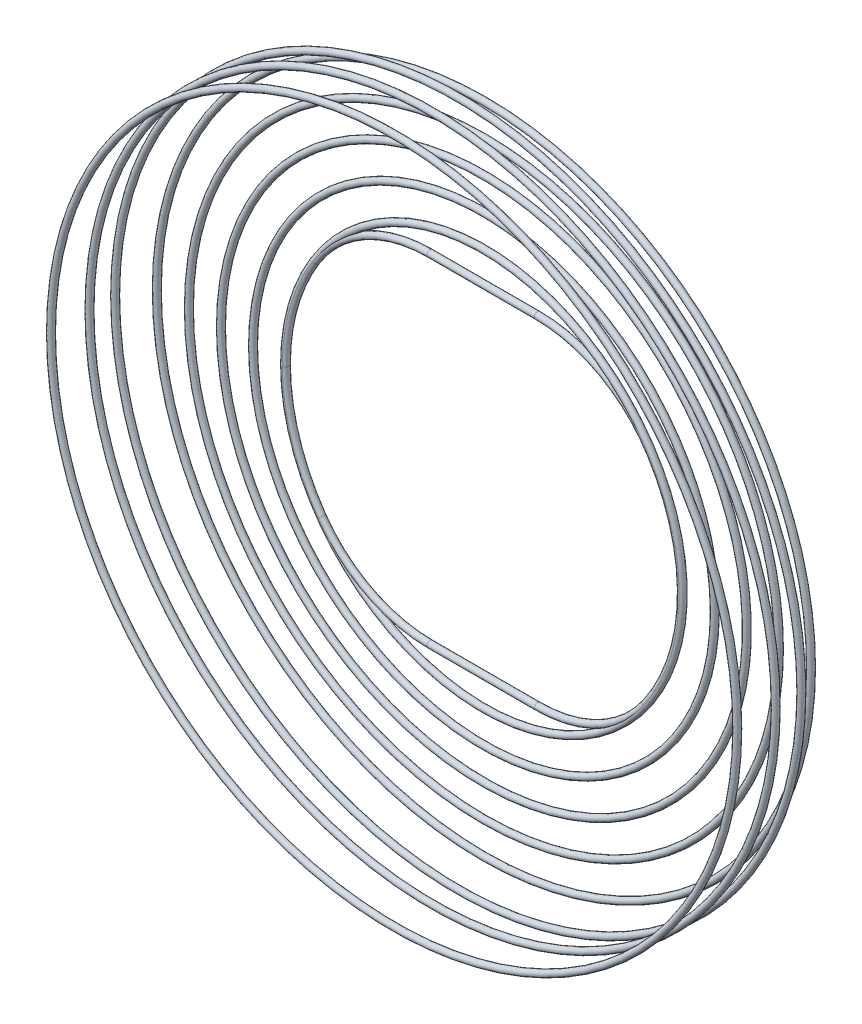
from build123d import *

# Parameters (mm, degrees)
SKETCH_4_R = 1
SKETCH_2_R = 1


with BuildPart() as part:
    # Эскиз4 → Повернуть1 (revolve)
    with BuildSketch(Plane(origin=(0, 0, 0), x_dir=(1, 0, 0), z_dir=(0, 1, 0))):
        with Locations((-62, 0)):
            Circle(SKETCH_4_R)
        with Locations((-72, 0)):
            Circle(SKETCH_4_R)
        with Locations((-82, 0)):
            Circle(SKETCH_4_R)
        with Locations((-92, 0)):
            Circle(SKETCH_4_R)
        with Locations((-102, 0)):
            Circle(SKETCH_4_R)
        with Locations((-107, -8)):
            Circle(SKETCH_4_R)
        with Locations((-107, -16)):
            Circle(SKETCH_4_R)
        with Locations((-107, -28)):
            Circle(SKETCH_4_R)
    revolve(axis=Axis((0, 0, -25.393789192), (0, 0, 1)))


with BuildPart() as body_2:
    # По траектории1: sweep along a path in Эскиз1
    with BuildLine(Plane.XY) as sweep_1_path:
        Line((-16.740207976, 52.490679576), (16.740207976, 52.490679576))
        ThreePointArc((16.740207976, 52.490679576), (37.084815097, 47.235069833), (52.338449888, 32.783388329))
        ThreePointArc((52.338449888, 32.783388329), (61.738330967, -1.56281044), (50.612760113, -35.389439114))
        ThreePointArc((50.612760113, -35.389439114), (35.837157204, -48.360301586), (16.740207976, -53.036651102))
        Line((16.740207976, -53.036651102), (-16.740207976, -53.036651102))
        ThreePointArc((-16.740207976, -53.036651102), (-35.837157204, -48.360301586), (-50.612760113, -35.389439114))
        ThreePointArc((-50.612760113, -35.389439114), (-61.738330967, -1.56281044), (-52.338449888, 32.783388329))
        ThreePointArc((-52.338449888, 32.783388329), (-37.084815097, 47.235069833), (-16.740207976, 52.490679576))
    # Эскиз2 → По траектории1 (sweep)
    with BuildSketch(Plane(origin=(0, 0, 0), x_dir=(1, 0, 0), z_dir=(0, 1, 0))):
        with Locations((-61.758107865, 0)):
            Circle(SKETCH_2_R)
    sweep(path=sweep_1_path.line)


solid = Compound([part.part, body_2.part])
